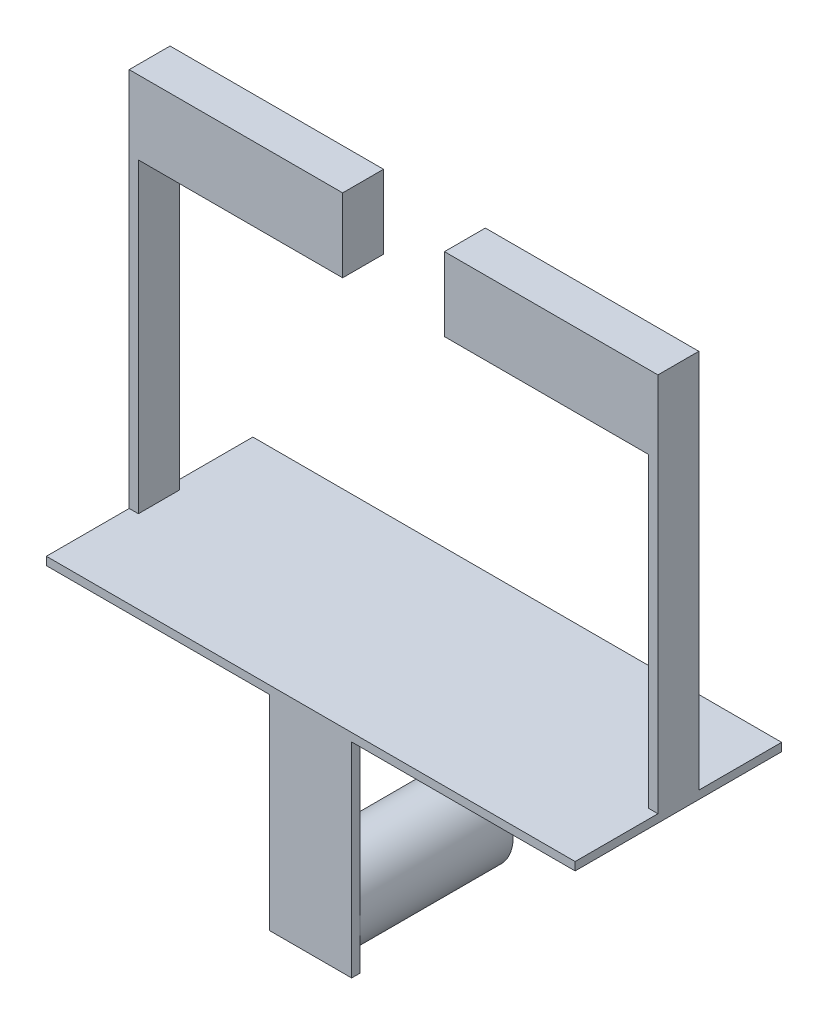
from build123d import *

# Parameters (mm, degrees)
SKETCH6_W            = 10.1981
SKETCH6_H            = 1.016
BOSS_EXTRUDE3_DEPTH  = 25.4
SKETCH8_R            = 5.09905
BOSS_EXTRUDE5_DEPTH  = 19.05
SKETCH11_W           = 65.69456
SKETCH11_H           = 25.654
BOSS_EXTRUDE10_DEPTH = 1.016
SKETCH16_W           = 1.143
SKETCH16_H           = 5.08
SKETCH16_W_2         = 1.155076163
BOSS_EXTRUDE11_DEPTH = 38.0746
SKETCH17_W           = 26.52268
SKETCH17_H           = 5.08
BOSS_EXTRUDE12_DEPTH = 9.144


with BuildPart() as part:
    # Sketch6 → Boss-Extrude3 (new body)
    with BuildSketch(Plane(origin=(0, 0, 0), x_dir=(1, 0, 0), z_dir=(0, 1, 0))):
        with Locations((-12.169797761, 8.14004804)):
            Rectangle(SKETCH6_W, SKETCH6_H)
    extrude(amount=BOSS_EXTRUDE3_DEPTH)

    # Sketch8 → Boss-Extrude5 (add)
    with BuildSketch(Plane.XY.offset(-8.64804804)):
        with Locations((-12.169797761, 5.098542)):
            Circle(SKETCH8_R)
    extrude(amount=-BOSS_EXTRUDE5_DEPTH)

    # Sketch11 → Boss-Extrude10 (add)
    with BuildSketch(Plane(origin=(0, 25.4, 0), x_dir=(1, 0, 0), z_dir=(0, 1, 0))):
        with Locations((-12.150747761, 20.45904804)):
            Rectangle(SKETCH11_W, SKETCH11_H)
    extrude(amount=BOSS_EXTRUDE10_DEPTH)

    # Sketch16 → Boss-Extrude11 (add)
    with BuildSketch(Plane(origin=(0, 26.416, 0), x_dir=(1, 0, 0), z_dir=(0, 1, 0))):
        with Locations((-44.426527761, 20.45904804)):
            Rectangle(SKETCH16_W, SKETCH16_H)
        with Locations((20.118994158, 20.45904804)):
            Rectangle(SKETCH16_W_2, SKETCH16_H)
    extrude(amount=BOSS_EXTRUDE11_DEPTH)

    # Sketch17 → Boss-Extrude12 (add)
    with BuildSketch(Plane(origin=(0, 64.4906, 0), x_dir=(1, 0, 0), z_dir=(0, 1, 0))):
        with Locations((-31.736687761, 20.45904804)):
            Rectangle(SKETCH17_W, SKETCH17_H)
        with Locations((7.435192239, 20.45904804)):
            Rectangle(SKETCH17_W, SKETCH17_H)
    extrude(amount=BOSS_EXTRUDE12_DEPTH)


solid = part.part
